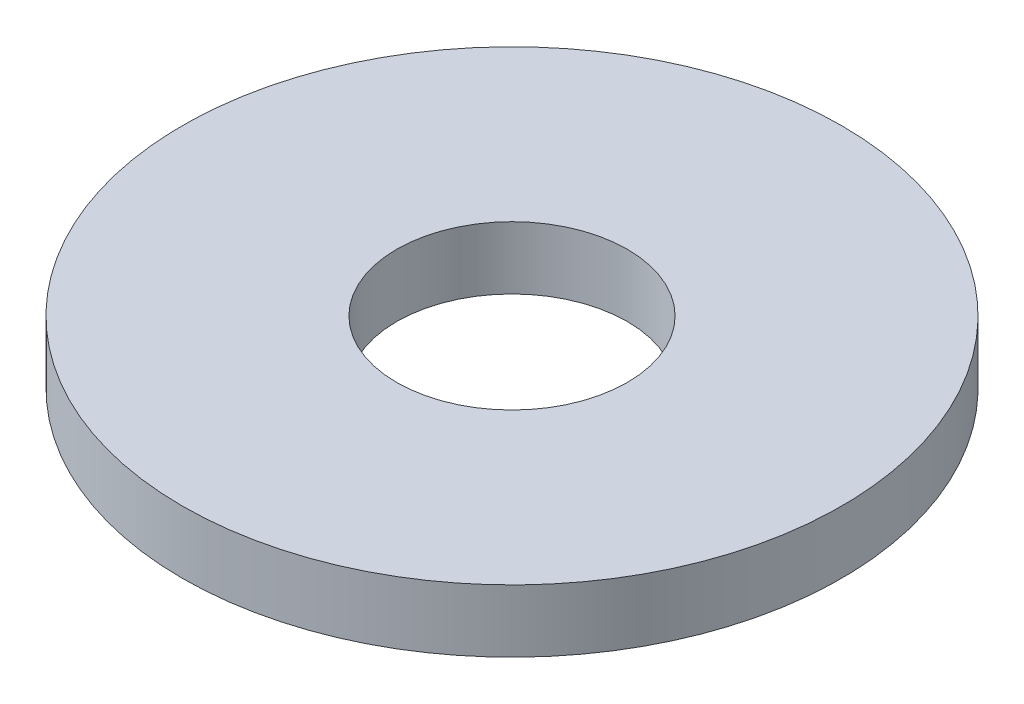
from build123d import *

# Parameters (mm, degrees)
SKETCH1_R           = 5
SKETCH1_R_2         = 1.75
BOSS_EXTRUDE1_DEPTH = 0.95


with BuildPart() as part:
    # Sketch1 → Boss-Extrude1 (new body)
    with BuildSketch(Plane(origin=(0, 0, 0), x_dir=(1, 0, 0), z_dir=(0, 1, 0))):
        with Locations(Location((0, 0, 0), (0, 0, 90))):
            Circle(SKETCH1_R)
        with Locations(Location((0, 0, 0), (0, 0, 90))):
            Circle(SKETCH1_R_2, mode=Mode.SUBTRACT)
    extrude(amount=BOSS_EXTRUDE1_DEPTH)


solid = part.part
